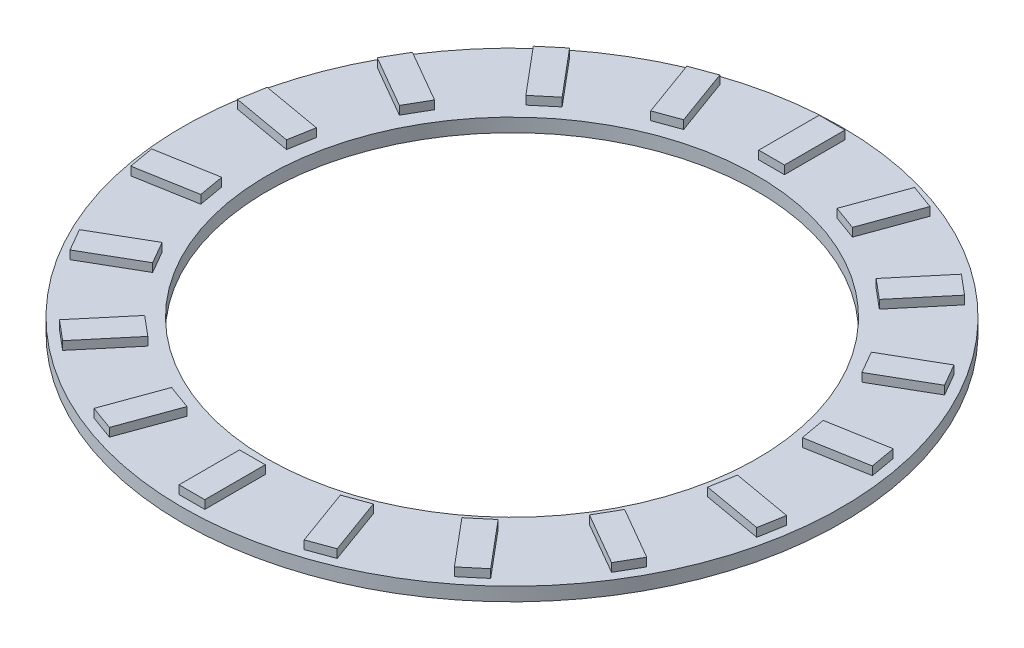
from build123d import *

# Parameters (mm, degrees)
SKETCH_1_R               = 39
SKETCH_1_R_2             = 29
EXTRUDE_1_DEPTH          = 1.6
SKETCH_2_W               = 3.045590862
SKETCH_2_H               = 7.157138524
EXTRUDE_2_DEPTH          = 1
PATTERN_CIRCULAR_1_COUNT = 18


with BuildPart() as part:
    # 草图1 → 凸台-拉伸1 (new body)
    with BuildSketch(Plane(origin=(0, 0, 0), x_dir=(1, 0, 0), z_dir=(0, 1, 0))):
        with Locations(Location((0, 0, 0), (0, 0, 270))):
            Circle(SKETCH_1_R)
        with Locations(Location((0, 0, 0), (0, 0, 270))):
            Circle(SKETCH_1_R_2, mode=Mode.SUBTRACT)
    extrude(amount=EXTRUDE_1_DEPTH)

    # 草图2 → 凸台-拉伸2 (add)
    with BuildSketch(Plane(origin=(0, 1.6, 0), x_dir=(1, 0, 0), z_dir=(0, 1, 0))):
        with Locations((0, 34.300967075)):
            Rectangle(SKETCH_2_W, SKETCH_2_H)
    extrude_2 = extrude(amount=EXTRUDE_2_DEPTH)

    # 阵列(圆周)1: 凸台-拉伸2 ×18 about axis
    pattern_circular_1_axis = Axis((0, 0, 0), (0, 1, 0))
    for i in range(1, PATTERN_CIRCULAR_1_COUNT):
        add(extrude_2.rotate(pattern_circular_1_axis, i * 360 / PATTERN_CIRCULAR_1_COUNT))


solid = part.part
